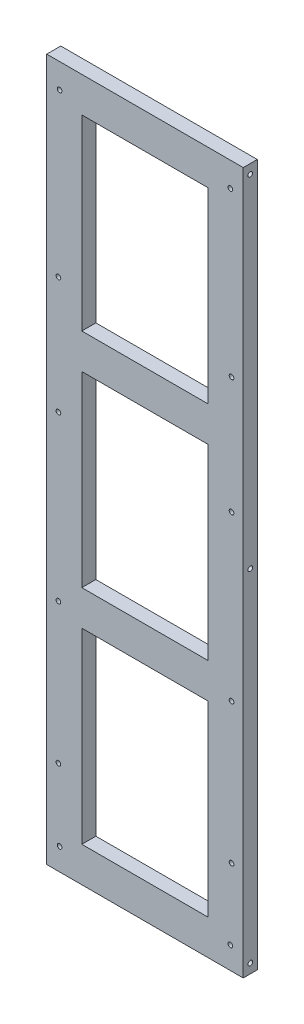
from build123d import *

# Parameters (mm, degrees)
SKETCH1_W           = 84
SKETCH1_H           = 300
SKETCH1_W_2         = 54
SKETCH1_H_2         = 80
BOSS_EXTRUDE1_DEPTH = 6
SKETCH2_R           = 1
CUT_EXTRUDE1_DEPTH  = 10
SKETCH4_R           = 1
CUT_EXTRUDE3_DEPTH  = 10
SKETCH5_R           = 1
CUT_EXTRUDE4_DEPTH  = 10


with BuildPart() as part:
    # Sketch1 → Boss-Extrude1 (new body)
    with BuildSketch(Plane.XY):
        Rectangle(SKETCH1_W, SKETCH1_H)
        with Locations((0, 95)):
            Rectangle(SKETCH1_W_2, SKETCH1_H_2, mode=Mode.SUBTRACT)
        with Locations((0, -95)):
            Rectangle(SKETCH1_W_2, SKETCH1_H_2, mode=Mode.SUBTRACT)
        Rectangle(SKETCH1_W_2, SKETCH1_H_2, mode=Mode.SUBTRACT)
    extrude(amount=BOSS_EXTRUDE1_DEPTH)

    # Sketch2 → Cut-Extrude1 (cut)
    with BuildSketch(Plane(origin=(42, 0, 0), x_dir=(0, 0, -1), z_dir=(1, 0, 0))):
        with Locations((-3, 146)):
            Circle(SKETCH2_R)
        with Locations((-3, 0)):
            Circle(SKETCH2_R)
        with Locations((-3, -146)):
            Circle(SKETCH2_R)
        with Locations((-3, -292)):
            Circle(SKETCH2_R)
    cut_extrude1 = extrude(amount=-CUT_EXTRUDE1_DEPTH, mode=Mode.SUBTRACT)

    # Mirror1: Cut-Extrude1 across plane
    add(cut_extrude1.mirror(Plane(origin=(0, 0, 0), x_dir=(0, 0, 1), z_dir=(1, 0, 0))), mode=Mode.SUBTRACT)

    # Sketch4 → Cut-Extrude3 (cut)
    with BuildSketch(Plane.XY.offset(6)):
        with Locations((-37, 70)):
            Circle(SKETCH4_R)
        with Locations((-37, 20)):
            Circle(SKETCH4_R)
        with Locations((-37, -50)):
            Circle(SKETCH4_R)
        with Locations((-37, -110)):
            Circle(SKETCH4_R)
        with Locations(Location((37, -110, 0), (0, 0, 180))):
            Circle(SKETCH4_R)
        with Locations(Location((37, -50, 0), (0, 0, 180))):
            Circle(SKETCH4_R)
        with Locations(Location((37, 20, 0), (0, 0, 180))):
            Circle(SKETCH4_R)
        with Locations(Location((37, 70, 0), (0, 0, 180))):
            Circle(SKETCH4_R)
    extrude(amount=-CUT_EXTRUDE3_DEPTH, mode=Mode.SUBTRACT)

    # Sketch5 → Cut-Extrude4 (cut)
    with BuildSketch(Plane.XY.offset(6)):
        with Locations((-36.5, -140.5)):
            Circle(SKETCH5_R)
        with Locations((36.5, -140.5)):
            Circle(SKETCH5_R)
        with Locations((-36.5, 139.5)):
            Circle(SKETCH5_R)
        with Locations((36.5, 139.5)):
            Circle(SKETCH5_R)
    extrude(amount=-CUT_EXTRUDE4_DEPTH, mode=Mode.SUBTRACT)


solid = part.part
